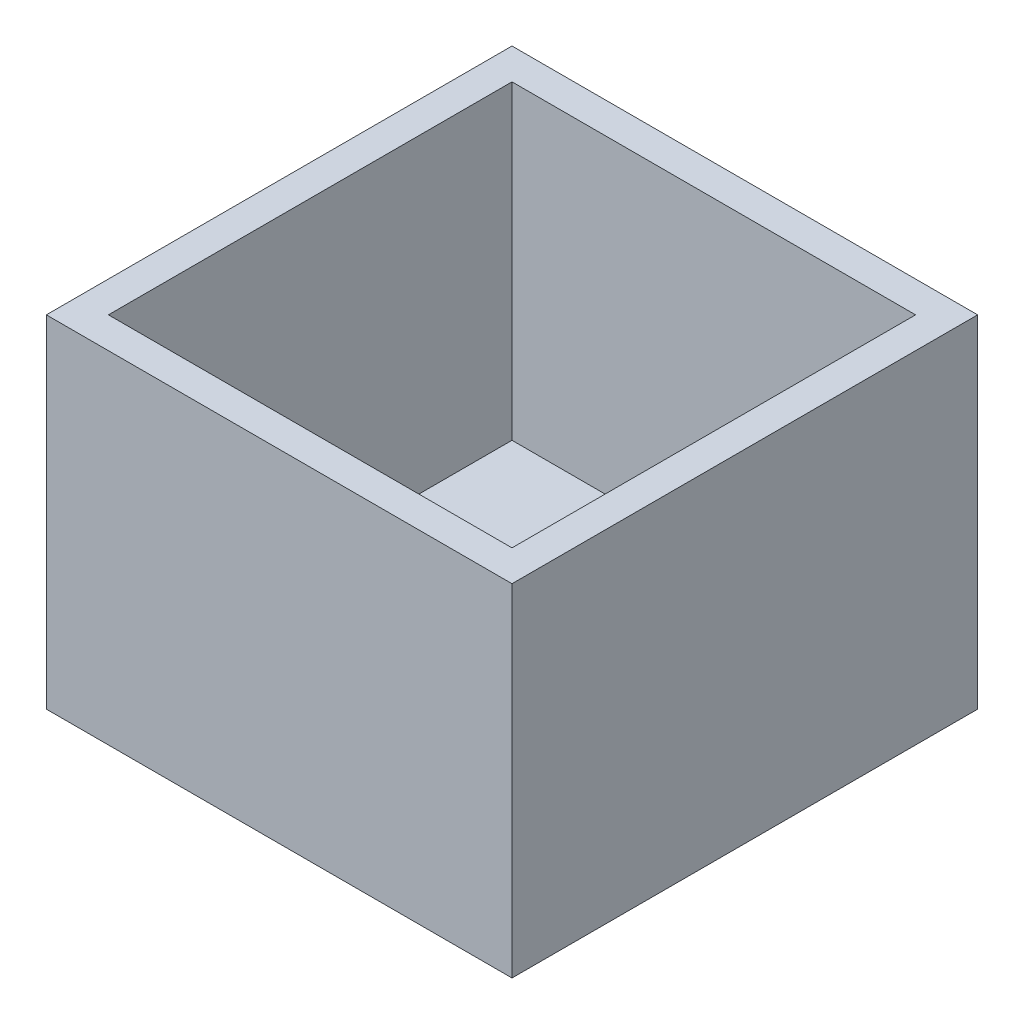
from build123d import *

# Parameters (mm, degrees)
SKETCH5_W           = 15
SKETCH5_H           = 15
SKETCH5_W_2         = 13
SKETCH5_H_2         = 13
BOSS_EXTRUDE1_DEPTH = 10
SKETCH6_W           = 15
SKETCH6_H           = 1
BOSS_EXTRUDE2_DEPTH = 15


with BuildPart() as part:
    # Sketch5 → Boss-Extrude1 (new body)
    with BuildSketch(Plane(origin=(0, 0, 0), x_dir=(1, 0, 0), z_dir=(0, 1, 0))):
        Rectangle(SKETCH5_W, SKETCH5_H)
        Rectangle(SKETCH5_W_2, SKETCH5_H_2, mode=Mode.SUBTRACT)
    extrude(amount=BOSS_EXTRUDE1_DEPTH)

    # Sketch6 → Boss-Extrude2 (add)
    with BuildSketch(Plane(origin=(0, 0, -7.5), x_dir=(-1, 0, 0), z_dir=(0, 0, -1))):
        with Locations((0, -0.5)):
            Rectangle(SKETCH6_W, SKETCH6_H)
    extrude(amount=-BOSS_EXTRUDE2_DEPTH)


solid = part.part
